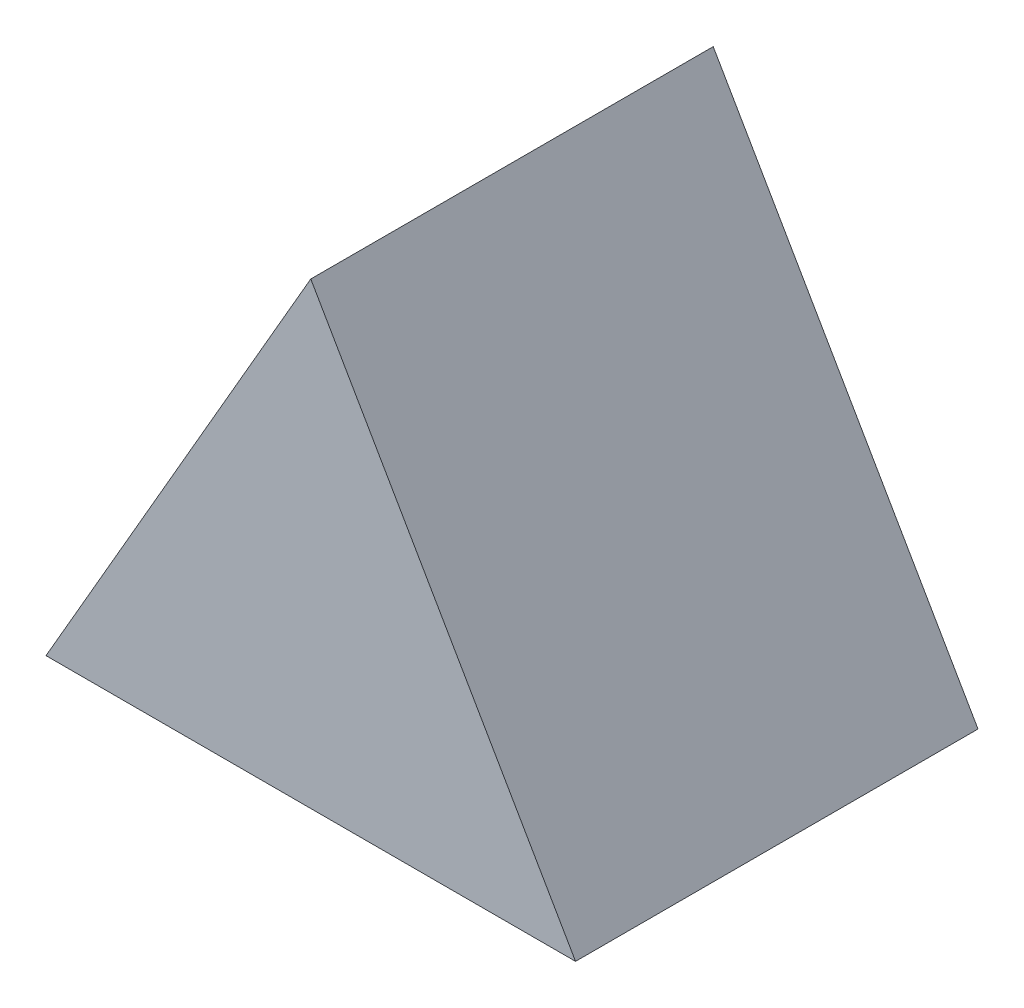
from build123d import *

# Parameters (mm, degrees)
EXTRUDE_1_DEPTH = 3.8


with BuildPart() as part:
    # Эскиз2 → Бобышка-Вытянуть1 (new body)
    with BuildSketch(Plane.XY):
        Polygon((-2.5, -2.265063509), (0, 2.065063509), (2.5, -2.265063509), align=None)
    extrude(amount=EXTRUDE_1_DEPTH)


solid = part.part
